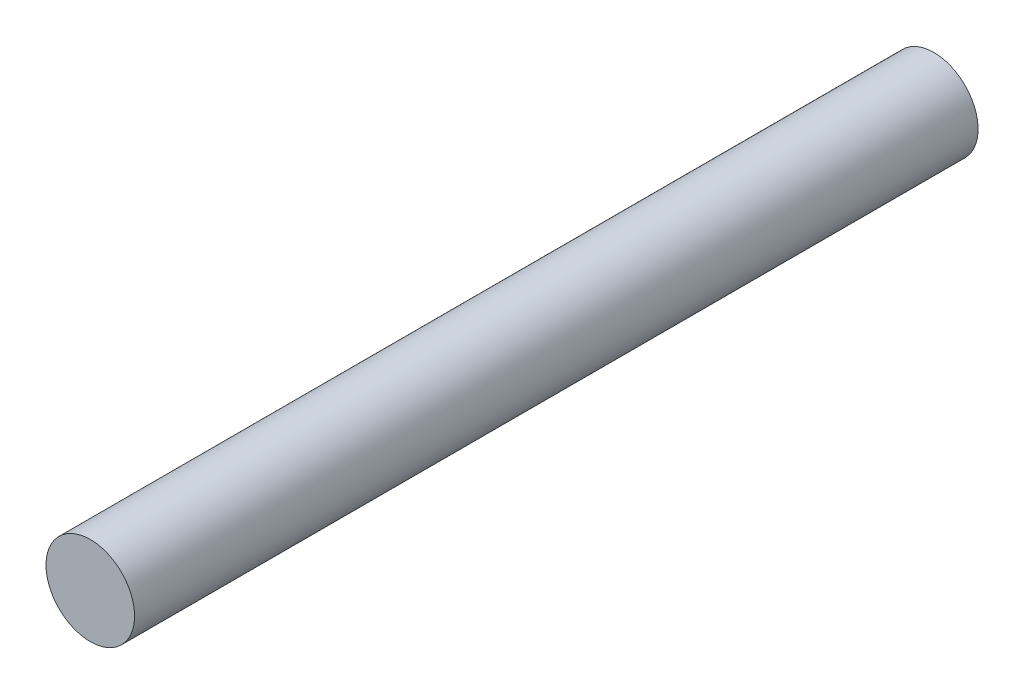
from build123d import *

# Parameters (mm, degrees)
ESQUISSE2_R        = 2
BOSS_EXTRU_1_DEPTH = 19.05


with BuildPart() as part:
    # Esquisse2 → Boss.-Extru.1 (new, symmetric)
    with BuildSketch(Plane.XY):
        with Locations(Location((0, 0, 0), (0, 0, 180))):
            Circle(ESQUISSE2_R)
    extrude(amount=BOSS_EXTRU_1_DEPTH, both=True)


solid = part.part
